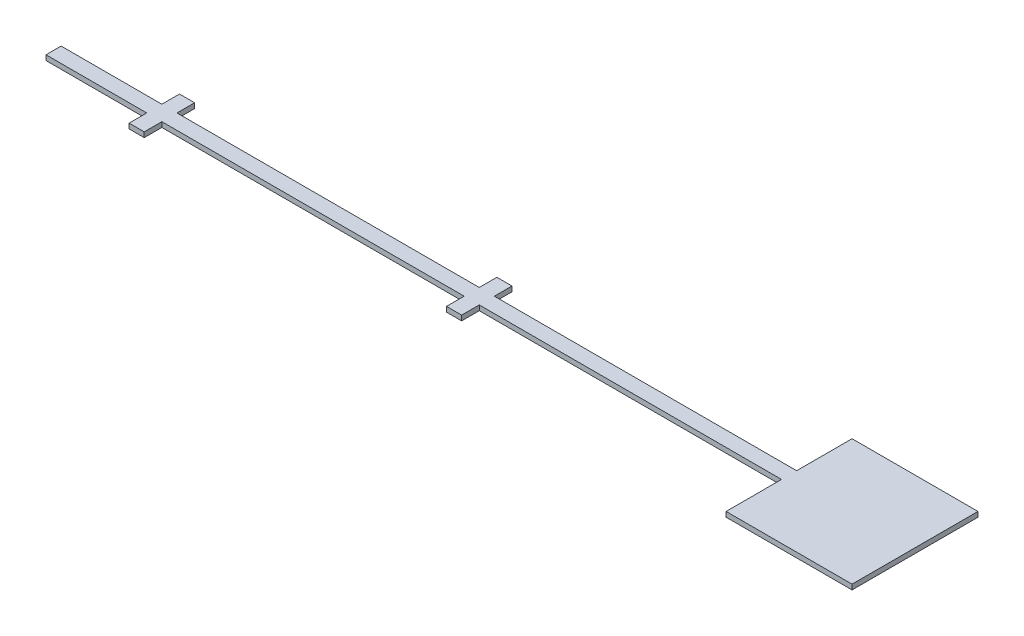
from build123d import *

# Parameters (mm, degrees)
BOSS_EXTRUDE1_DEPTH = 1


with BuildPart() as part:
    # Sketch1 → Boss-Extrude1 (new body)
    with BuildSketch(Plane(origin=(0, 0, 0), x_dir=(1, 0, 0), z_dir=(0, 1, 0))):
        Polygon((-47.714285714, 5.952380952), (-47.714285714, 2.952380952), (-27.714285714, 2.952380952), (-27.714285714, -0.547619048), (-24.714285714, -0.547619048), (-24.714285714, 2.952380952), (35.285714286, 2.952380952), (35.285714286, -0.547619048), (38.285714286, -0.547619048), (38.285714286, 2.952380952), (98.285714286, 2.952380952), (98.285714286, -8.047619048), (123.285714286, -8.047619048), (123.285714286, 16.952380952), (98.285714286, 16.952380952), (98.285714286, 5.952380952), (38.285714286, 5.952380952), (38.285714286, 9.452380952), (35.285714286, 9.452380952), (35.285714286, 5.952380952), (-24.714285714, 5.952380952), (-24.714285714, 9.452380952), (-27.714285714, 9.452380952), (-27.714285714, 5.952380952), align=None)
    extrude(amount=BOSS_EXTRUDE1_DEPTH)


solid = part.part
